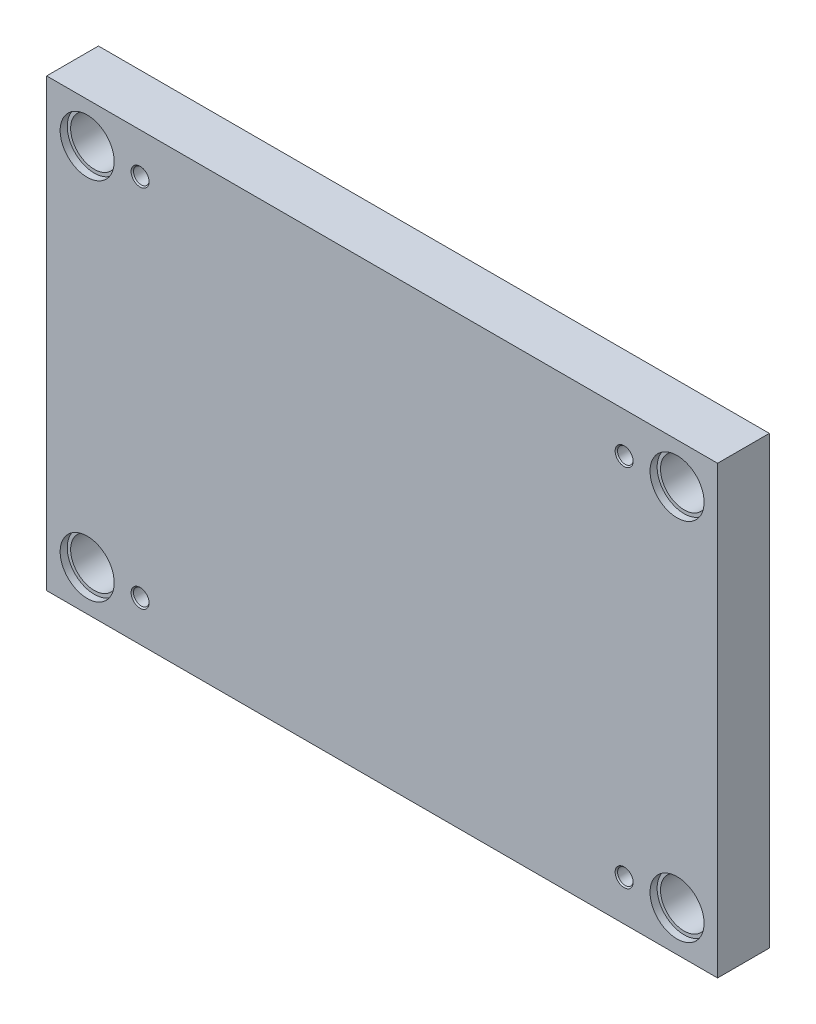
from build123d import *

# Parameters (mm, degrees)
SZKIC1_W                    = 596
SZKIC1_H                    = 396
DODANIE_WYCI_GNI_CIE1_DEPTH = 46
SZKIC2_R                    = 21
WYTNIJ_WYCI_GNI_CIE1_DEPTH  = 46
SZKIC3_R                    = 21
WYTNIJ_WYCI_GNI_CIE2_DEPTH  = 46
SZKIC4_R                    = 21
WYTNIJ_WYCI_GNI_CIE3_DEPTH  = 46
SZKIC5_R                    = 21
WYTNIJ_WYCI_GNI_CIE4_DEPTH  = 46
SZKIC6_R                    = 24
WYTNIJ_WYCI_GNI_CIE5_DEPTH  = 6.3
SZKIC7_R                    = 24
WYTNIJ_WYCI_GNI_CIE6_DEPTH  = 6.3
SZKIC8_R                    = 24
WYTNIJ_WYCI_GNI_CIE7_DEPTH  = 6.3
SZKIC9_R                    = 24
WYTNIJ_WYCI_GNI_CIE8_DEPTH  = 6.3


with BuildPart() as part:
    # Szkic1 → Dodanie-wyciągnięcie1 (new body)
    with BuildSketch(Plane.XY):
        Rectangle(SZKIC1_W, SZKIC1_H)
    extrude(amount=DODANIE_WYCI_GNI_CIE1_DEPTH)

    # Szkic2 → Wytnij-wyciągnięcie1 (cut)
    with BuildSketch(Plane.XY.offset(46)):
        with Locations((262, 162)):
            Circle(SZKIC2_R)
    extrude(amount=-WYTNIJ_WYCI_GNI_CIE1_DEPTH, mode=Mode.SUBTRACT)

    # Szkic3 → Wytnij-wyciągnięcie2 (cut)
    with BuildSketch(Plane.XY.offset(46)):
        with Locations((262, -162)):
            Circle(SZKIC3_R)
    extrude(amount=-WYTNIJ_WYCI_GNI_CIE2_DEPTH, mode=Mode.SUBTRACT)

    # Szkic4 → Wytnij-wyciągnięcie3 (cut)
    with BuildSketch(Plane.XY.offset(46)):
        with Locations((-262, -162)):
            Circle(SZKIC4_R)
    extrude(amount=-WYTNIJ_WYCI_GNI_CIE3_DEPTH, mode=Mode.SUBTRACT)

    # Szkic5 → Wytnij-wyciągnięcie4 (cut)
    with BuildSketch(Plane.XY.offset(46)):
        with Locations((-262, 162)):
            Circle(SZKIC5_R)
    extrude(amount=-WYTNIJ_WYCI_GNI_CIE4_DEPTH, mode=Mode.SUBTRACT)

    # Szkic6 → Wytnij-wyciągnięcie5 (cut)
    with BuildSketch(Plane.XY.offset(46)):
        with Locations((-262, 162)):
            Circle(SZKIC6_R)
    extrude(amount=-WYTNIJ_WYCI_GNI_CIE5_DEPTH, mode=Mode.SUBTRACT)

    # Szkic7 → Wytnij-wyciągnięcie6 (cut)
    with BuildSketch(Plane.XY.offset(46)):
        with Locations((262, 162)):
            Circle(SZKIC7_R)
    extrude(amount=-WYTNIJ_WYCI_GNI_CIE6_DEPTH, mode=Mode.SUBTRACT)

    # Szkic8 → Wytnij-wyciągnięcie7 (cut)
    with BuildSketch(Plane.XY.offset(46)):
        with Locations((-262, -162)):
            Circle(SZKIC8_R)
    extrude(amount=-WYTNIJ_WYCI_GNI_CIE7_DEPTH, mode=Mode.SUBTRACT)

    # Szkic9 → Wytnij-wyciągnięcie8 (cut)
    with BuildSketch(Plane.XY.offset(46)):
        with Locations((262, -162)):
            Circle(SZKIC9_R)
    extrude(amount=-WYTNIJ_WYCI_GNI_CIE8_DEPTH, mode=Mode.SUBTRACT)

    # Szkic10 → Wycięcie-obrót1 (revolve, cut)
    with BuildSketch(Plane(origin=(-215, 0, 0), x_dir=(0, 0, -1), z_dir=(1, 0, 0))):
        Polygon((-46, 162), (-46, 170), (-44.9175, 168.9175), (-6, 168.9175), (-2.006179513, 162), align=None)
    revolve(axis=Axis((-215, 162, 2.006179513), (0, 0, 1)), mode=Mode.SUBTRACT)

    # Szkic11 → Wycięcie-obrót2 (revolve, cut)
    with BuildSketch(Plane(origin=(-215, 0, 0), x_dir=(0, 0, -1), z_dir=(1, 0, 0))):
        Polygon((-2.006179513, -162), (-6, -168.9175), (-44.9175, -168.9175), (-46, -170), (-46, -162), align=None)
    revolve(axis=Axis((-215, -162, 46), (0, 0, -1)), mode=Mode.SUBTRACT)

    # Szkic12 → Wycięcie-obrót3 (revolve, cut)
    with BuildSketch(Plane(origin=(215, 0, 0), x_dir=(0, 0, -1), z_dir=(1, 0, 0))):
        Polygon((-46, 162), (-46, 170), (-44.9175, 168.9175), (-6, 168.9175), (-2.006179513, 162), align=None)
    revolve(axis=Axis((215, 162, 2.006179513), (0, 0, 1)), mode=Mode.SUBTRACT)

    # Szkic13 → Wycięcie-obrót4 (revolve, cut)
    with BuildSketch(Plane(origin=(215, 0, 0), x_dir=(0, 0, -1), z_dir=(1, 0, 0))):
        Polygon((-2.006179513, -162), (-6, -168.9175), (-44.9175, -168.9175), (-46, -170), (-46, -162), align=None)
    revolve(axis=Axis((215, -162, 46), (0, 0, -1)), mode=Mode.SUBTRACT)


solid = part.part
